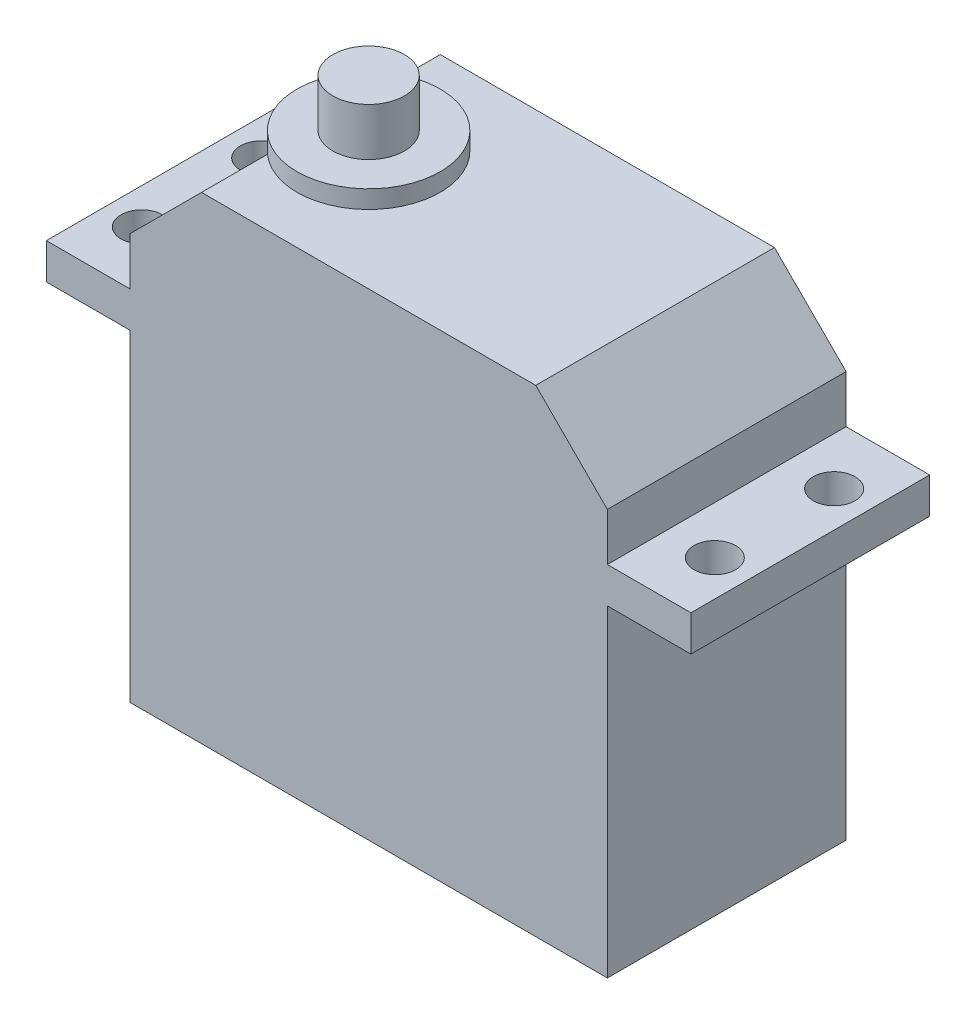
from build123d import *

# Parameters (mm, degrees)
SKETCH_1_W           = 40
SKETCH_1_H           = 40
EXTRUDE_1_DEPTH      = 10
SKETCH_2_W           = 54
SKETCH_2_H           = 3
EXTRUDE_2_DEPTH      = 10
CHAMFER_1_SIZE       = 6
EXTRUDE_3_DEPTH      = 1.5
EXTRUDE_3_DEPTH_BACK = 20
SKETCH_4_R           = 6
SKETCH_5_R           = 3
EXTRUDE_4_DEPTH      = 4
SKETCH_6_R           = 1.75
CUT_EXTRUDE_1_DEPTH  = 57.648036153


with BuildPart() as part:
    # 草图1 → 凸台-拉伸1 (new, symmetric)
    with BuildSketch(Plane.XY):
        with Locations((20, 20)):
            Rectangle(SKETCH_1_W, SKETCH_1_H)
    extrude(amount=EXTRUDE_1_DEPTH, both=True)

    # 草图2 → 凸台-拉伸2 (add, symmetric)
    with BuildSketch(Plane.XY):
        with Locations((20, 28.5)):
            Rectangle(SKETCH_2_W, SKETCH_2_H)
    extrude(amount=EXTRUDE_2_DEPTH, both=True)

    # 倒角1
    chamfer_1_edges = [part.edges().sort_by_distance(p)[0] for p in [
        (0, 40, 0),
        (40, 40, 0),
    ]]
    chamfer(chamfer_1_edges, length=CHAMFER_1_SIZE)

    # 草图4 → 凸台-拉伸3 (add, two sides: drawn at the far end of the back side and taken through both)
    with BuildSketch(Plane(origin=(0, 40, 0), x_dir=(1, 0, 0), z_dir=(0, 1, 0)).offset(-EXTRUDE_3_DEPTH_BACK)):
        with Locations(Location((10, 0, 0), (0, 0, 270))):
            Circle(SKETCH_4_R)
    extrude(amount=EXTRUDE_3_DEPTH + EXTRUDE_3_DEPTH_BACK)

    # 草图5 → 凸台-拉伸4 (add)
    with BuildSketch(Plane(origin=(0, 41.5, 0), x_dir=(1, 0, 0), z_dir=(0, 1, 0))):
        with Locations(Location((10, 0, 0), (0, 0, 270))):
            Circle(SKETCH_5_R)
    extrude(amount=EXTRUDE_4_DEPTH)

    # 草图6 → 切除-拉伸1 (cut, through all)
    with BuildSketch(Plane(origin=(0, 30, 0), x_dir=(1, 0, 0), z_dir=(0, 1, 0))):
        with Locations(Location((-4, 5, 0), (0, 0, 270))):
            Circle(SKETCH_6_R)
        with Locations(Location((-4, -5, 0), (0, 0, 270))):
            Circle(SKETCH_6_R)
        with Locations(Location((44, 5, 0), (0, 0, 270))):
            Circle(SKETCH_6_R)
        with Locations(Location((44, -5, 0), (0, 0, 270))):
            Circle(SKETCH_6_R)
    extrude(amount=-CUT_EXTRUDE_1_DEPTH, mode=Mode.SUBTRACT)


solid = part.part
